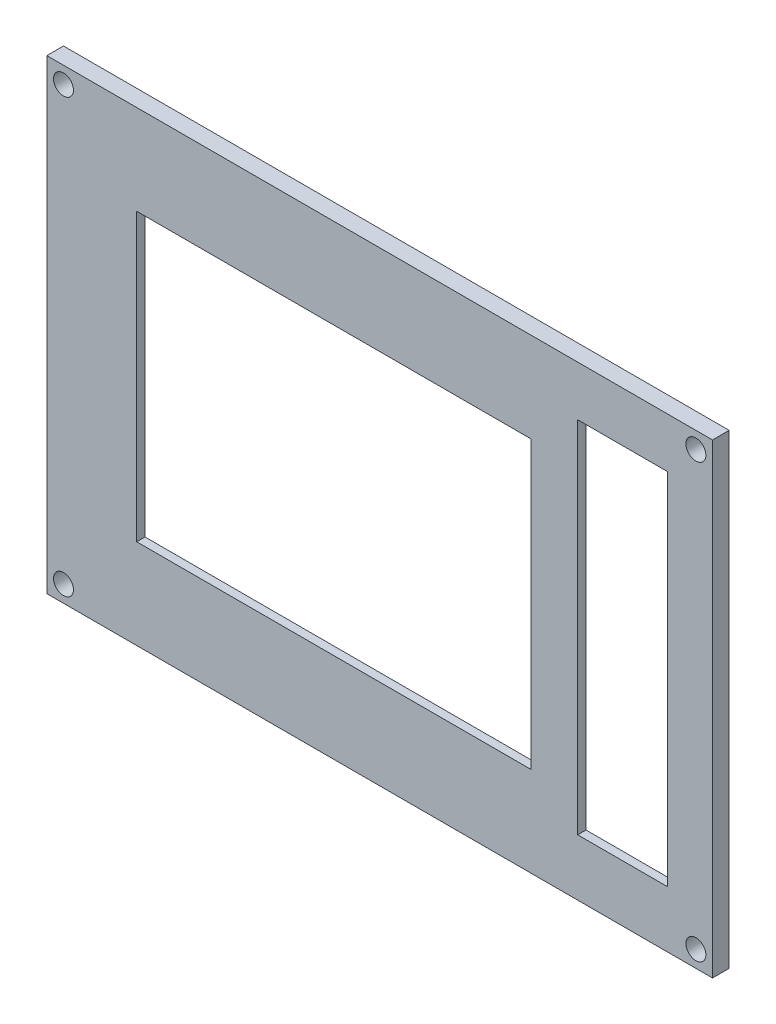
from build123d import *

# Parameters (mm, degrees)
SKETCH1_W           = 90
SKETCH1_H           = 60
SKETCH1_W_2         = 59.25
SKETCH1_H_2         = 43
BOSS_EXTRUDE3_DEPTH = 1.25
SKETCH1_6_W         = 100
SKETCH1_6_H         = 70
SKETCH1_6_R         = 1.5
SKETCH1_6_W_2       = 90
SKETCH1_6_H_2       = 60
BOSS_EXTRUDE4_DEPTH = 2.5


with BuildPart() as part:
    # Sketch1 → Boss-Extrude3 (new body)
    with BuildSketch(Plane.XY):
        with Locations((45, 30)):
            Rectangle(SKETCH1_W, SKETCH1_H)
        with Locations((38.125, 30)):
            Rectangle(SKETCH1_W_2, SKETCH1_H_2, mode=Mode.SUBTRACT)
        Polygon((74.75, 3.5), (74.75, 54.5), (74.75, 57.5), (88.25, 57.5), (88.25, 3.5), align=None, mode=Mode.SUBTRACT)
    extrude(amount=-BOSS_EXTRUDE3_DEPTH)

    # Sketch1<6> → Boss-Extrude4 (add)
    with BuildSketch(Plane.XY):
        with Locations((45, 30)):
            Rectangle(SKETCH1_6_W, SKETCH1_6_H)
        with Locations((-2.5, -2.5)):
            Circle(SKETCH1_6_R, mode=Mode.SUBTRACT)
        with Locations((92.5, -2.5)):
            Circle(SKETCH1_6_R, mode=Mode.SUBTRACT)
        with Locations((45, 30)):
            Rectangle(SKETCH1_6_W_2, SKETCH1_6_H_2, mode=Mode.SUBTRACT)
        with Locations((-2.5, 62.5)):
            Circle(SKETCH1_6_R, mode=Mode.SUBTRACT)
        with Locations((92.5, 62.5)):
            Circle(SKETCH1_6_R, mode=Mode.SUBTRACT)
    extrude(amount=-BOSS_EXTRUDE4_DEPTH)


solid = part.part
